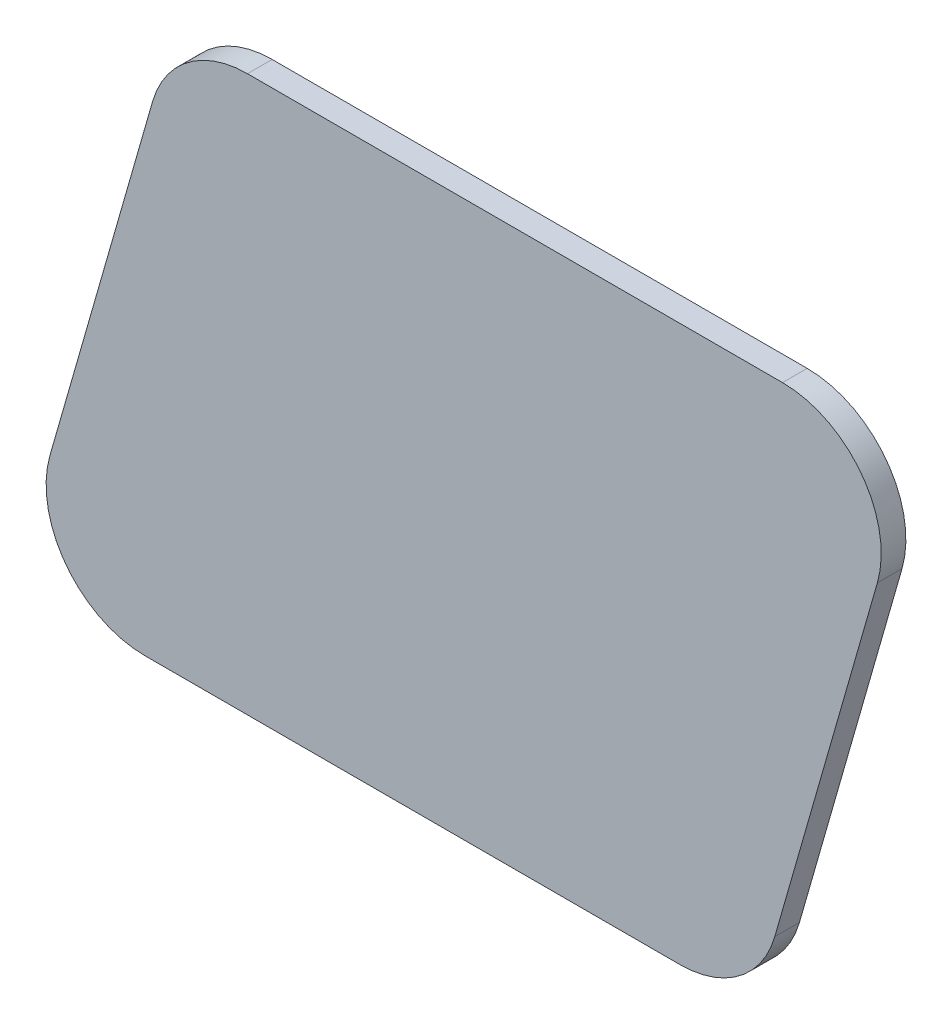
from build123d import *

# Parameters (mm, degrees)
BOSS_EXTRUDE1_DEPTH = 2


with BuildPart() as part:
    # Sketch1 → Boss-Extrude1 (new body)
    with BuildSketch(Plane.XY):
        with BuildLine():
            Line((10.617270408, 0), (53.972085334, 0))
            ThreePointArc((53.972085334, 0), (58.786341781, 1.610717187), (61.661996827, 5.794266283))
            Line((61.661996827, 5.794266283), (69.98020411, 34.794266283))
            ThreePointArc((69.98020411, 34.794266283), (68.679575431, 41.814256447), (62.290292617, 45))
            Line((62.290292617, 45), (18.935477691, 45))
            ThreePointArc((18.935477691, 45), (14.121221244, 43.389282813), (11.245566198, 39.205733717))
            Line((11.245566198, 39.205733717), (2.927358915, 10.205733717))
            ThreePointArc((2.927358915, 10.205733717), (4.227987595, 3.185743553), (10.617270408, 0))
        make_face()
    extrude(amount=BOSS_EXTRUDE1_DEPTH)


solid = part.part
